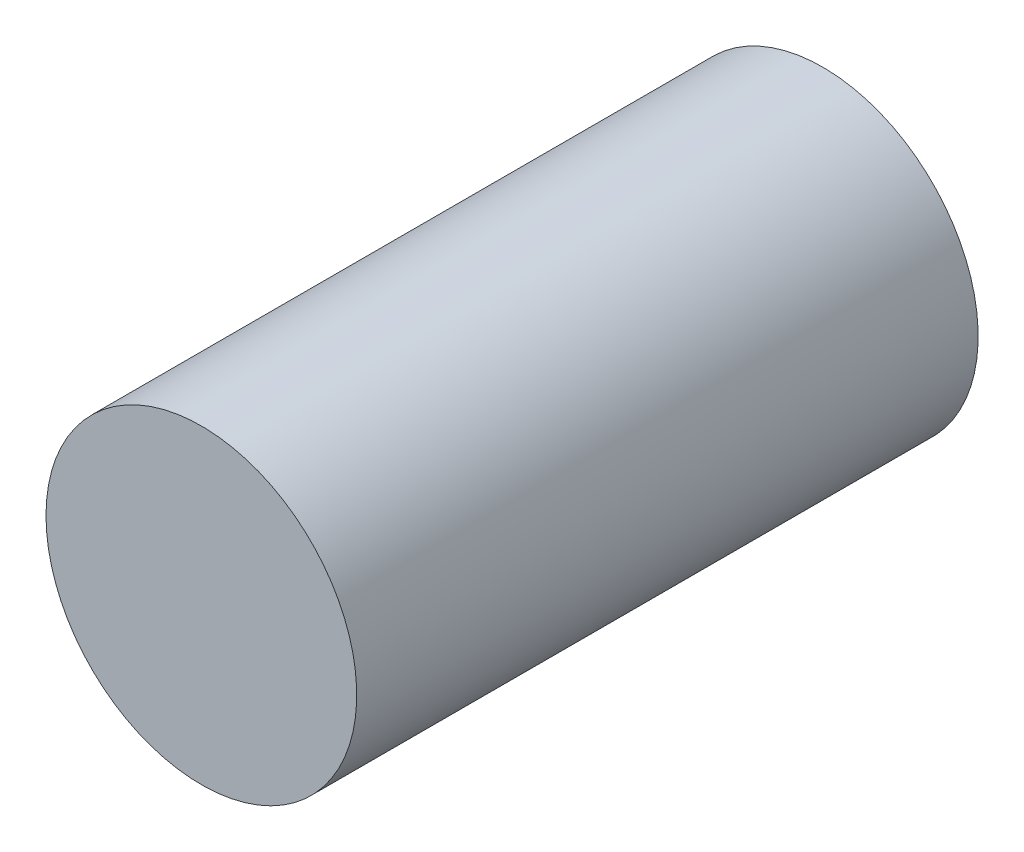
from build123d import *

# Parameters (mm, degrees)
SKETCH2_R           = 9.525
BOSS_EXTRUDE1_DEPTH = 38.1


with BuildPart() as part:
    # Sketch2 → Boss-Extrude1 (new body)
    with BuildSketch(Plane(origin=(0, 0, 0), x_dir=(0, 1, 0), z_dir=(0, 0, 1))):
        with Locations(Location((0, 0, 0), (0, 0, 90))):
            Circle(SKETCH2_R)
    extrude(amount=BOSS_EXTRUDE1_DEPTH)


solid = part.part
